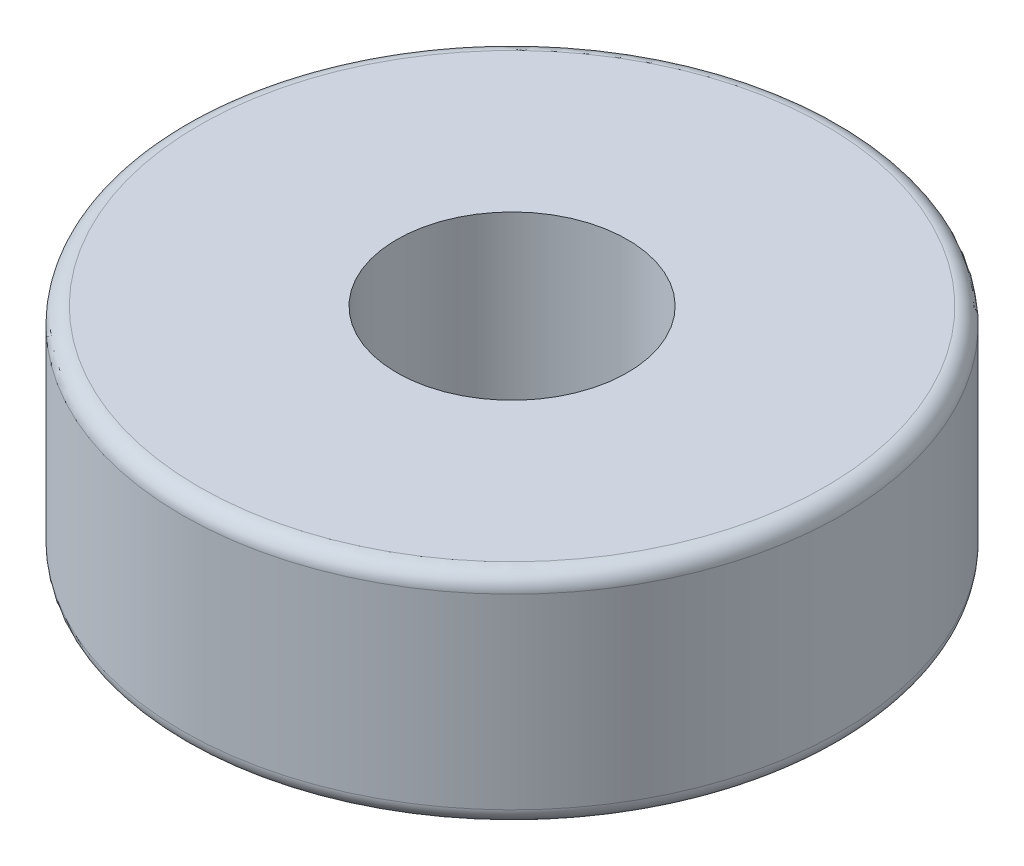
from build123d import *

# Parameters (mm, degrees)
SKETCH1_R           = 30
SKETCH1_R_2         = 10.5
BOSS_EXTRUDE1_DEPTH = 20
FILLET1_R           = 1.5


with BuildPart() as part:
    # Sketch1 → Boss-Extrude1 (new body)
    with BuildSketch(Plane(origin=(0, 0, 0), x_dir=(1, 0, 0), z_dir=(0, 1, 0))):
        with Locations(Location((0, 0, 0), (0, 0, 270))):
            Circle(SKETCH1_R)
        with Locations(Location((0, 0, 0), (0, 0, 270))):
            Circle(SKETCH1_R_2, mode=Mode.SUBTRACT)
    extrude(amount=BOSS_EXTRUDE1_DEPTH)

    # Fillet1
    fillet1_edges = [part.edges().sort_by_distance(p)[0] for p in [
        (0, 0, -30),
        (0, 20, -30),
    ]]
    fillet(fillet1_edges, radius=FILLET1_R)


solid = part.part
